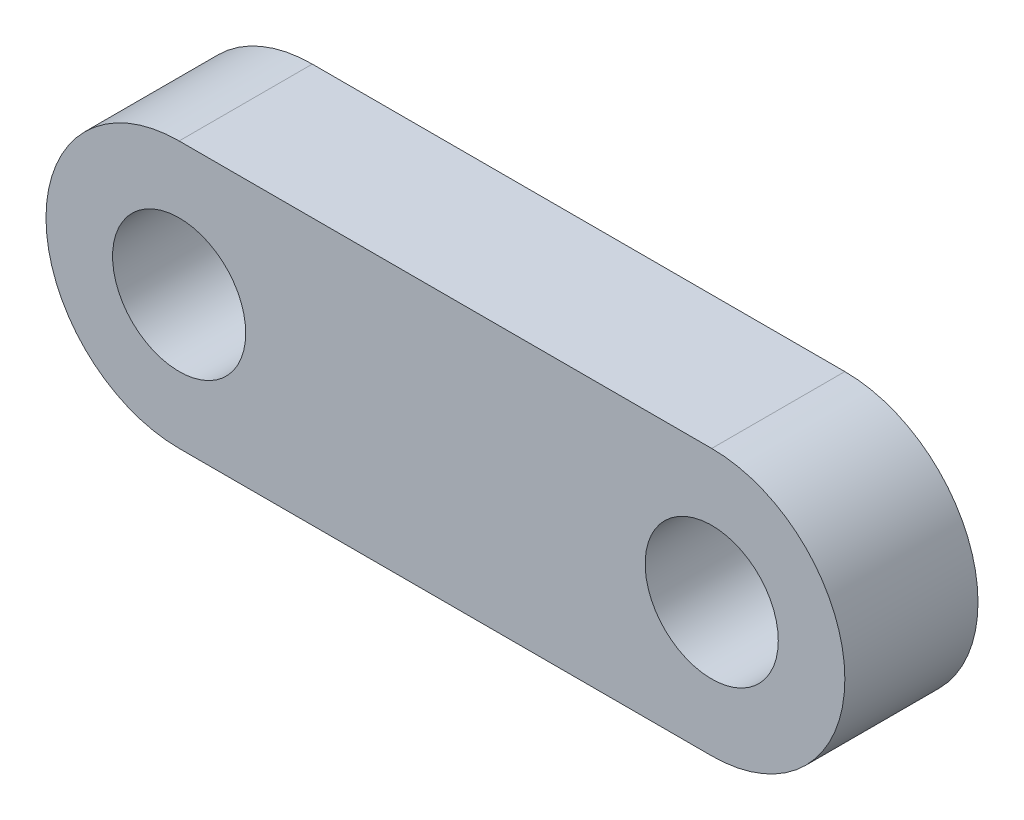
from build123d import *

# Parameters (mm, degrees)
SKETCH1_R           = 2.5
BOSS_EXTRUDE1_DEPTH = 5


with BuildPart() as part:
    # Sketch1 → Boss-Extrude1 (new body)
    with BuildSketch(Plane.XY):
        with BuildLine():
            Line((-40, 20), (-60, 20))
            ThreePointArc((-60, 20), (-65, 25), (-60, 30))
            Line((-60, 30), (-40, 30))
            ThreePointArc((-40, 30), (-35, 25), (-40, 20))
        make_face()
        with Locations((-40, 25)):
            Circle(SKETCH1_R, mode=Mode.SUBTRACT)
        with Locations((-60, 25)):
            Circle(SKETCH1_R, mode=Mode.SUBTRACT)
    extrude(amount=-BOSS_EXTRUDE1_DEPTH)


solid = part.part
